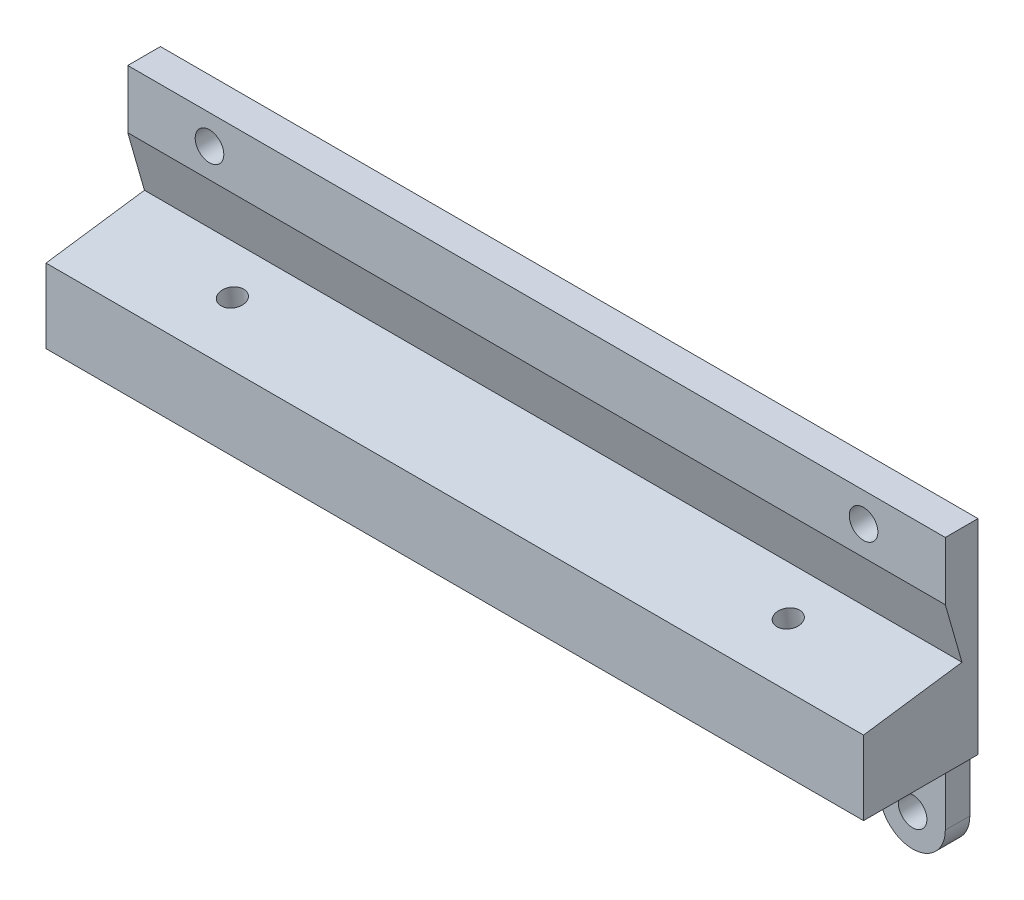
from build123d import *

# Parameters (mm, degrees)
SKETCH_1_W          = 100
SKETCH_1_H          = 25
EXTRUDE_1_DEPTH     = 4
SKETCH_2_W          = 100
SKETCH_2_H          = 10.76
EXTRUDE_2_DEPTH     = 10
CUT_EXTRUDE_1_DEPTH = 105.024035684
SKETCH_6_R          = 1.4
CUT_EXTRUDE_2_DEPTH = 102.768128406
SKETCH_7_R          = 1.75
EXTRUDE_3_DEPTH     = 3
SKETCH_8_R          = 1.75
CUT_EXTRUDE_3_DEPTH = 104.561575886


with BuildPart() as part:
    # 스케치1 → 보스-돌출1 (new body)
    with BuildSketch(Plane.XY):
        with Locations((50, 12.5)):
            Rectangle(SKETCH_1_W, SKETCH_1_H)
    extrude(amount=EXTRUDE_1_DEPTH)

    # 스케치2 → 보스-돌출2 (add)
    with BuildSketch(Plane.XY.offset(4)):
        with Locations((50, 5.38)):
            Rectangle(SKETCH_2_W, SKETCH_2_H)
    extrude(amount=EXTRUDE_2_DEPTH)

    # 스케치5 → 컷-돌출1 (cut, through all)
    with BuildSketch(Plane.ZY):
        Polygon((1.96, 10.76), (19, 8.365184177), (4, 17.874325465), align=None)
    extrude(amount=-CUT_EXTRUDE_1_DEPTH, mode=Mode.SUBTRACT)

    # 스케치6 → 컷-돌출2 (cut, through all)
    with BuildSketch(Plane(origin=(0, 10.821712533, 1.520892512), x_dir=(1, 0, 0), z_dir=(0, 0.9902680687415709, 0.1391731009600619))):
        with Locations(Location((16, -5.741746822, 0), (0, 0, 270))):
            Circle(SKETCH_6_R)
        with Locations(Location((84, -5.741746822, 0), (0, 0, 270))):
            Circle(SKETCH_6_R)
    extrude(amount=-CUT_EXTRUDE_2_DEPTH, mode=Mode.SUBTRACT)

    # 스케치7 → 보스-돌출3 (add)
    # profile 1 of 2: a face of its own
    with BuildSketch(Plane(origin=(0, 0, 0), x_dir=(-1, 0, 0), z_dir=(0, 0, -1))):
        with BuildLine():
            Line((-99, -7), (-99, 0))
            Line((-99, 0), (-91, 0))
            Line((-91, 0), (-91, -7))
            ThreePointArc((-91, -7), (-95, -11), (-99, -7))
        make_face()
        with Locations((-95, -7)):
            Circle(SKETCH_7_R, mode=Mode.SUBTRACT)
    # profile 2 of 2: a face of its own
    with BuildSketch(Plane(origin=(0, 0, 0), x_dir=(-1, 0, 0), z_dir=(0, 0, -1))):
        with BuildLine():
            Line((-9, -7), (-9, 0))
            Line((-9, 0), (-1, 0))
            Line((-1, 0), (-1, -7))
            ThreePointArc((-1, -7), (-5, -11), (-9, -7))
        make_face()
        with Locations((-5, -7)):
            Circle(SKETCH_7_R, mode=Mode.SUBTRACT)
    extrude(amount=-EXTRUDE_3_DEPTH)

    # 스케치8 → 컷-돌출3 (cut, through all)
    with BuildSketch(Plane.XY.offset(4)):
        with Locations((10, 21.437162733)):
            Circle(SKETCH_8_R)
        with Locations((90, 21.437162733)):
            Circle(SKETCH_8_R)
    extrude(amount=-CUT_EXTRUDE_3_DEPTH, mode=Mode.SUBTRACT)


solid = part.part
